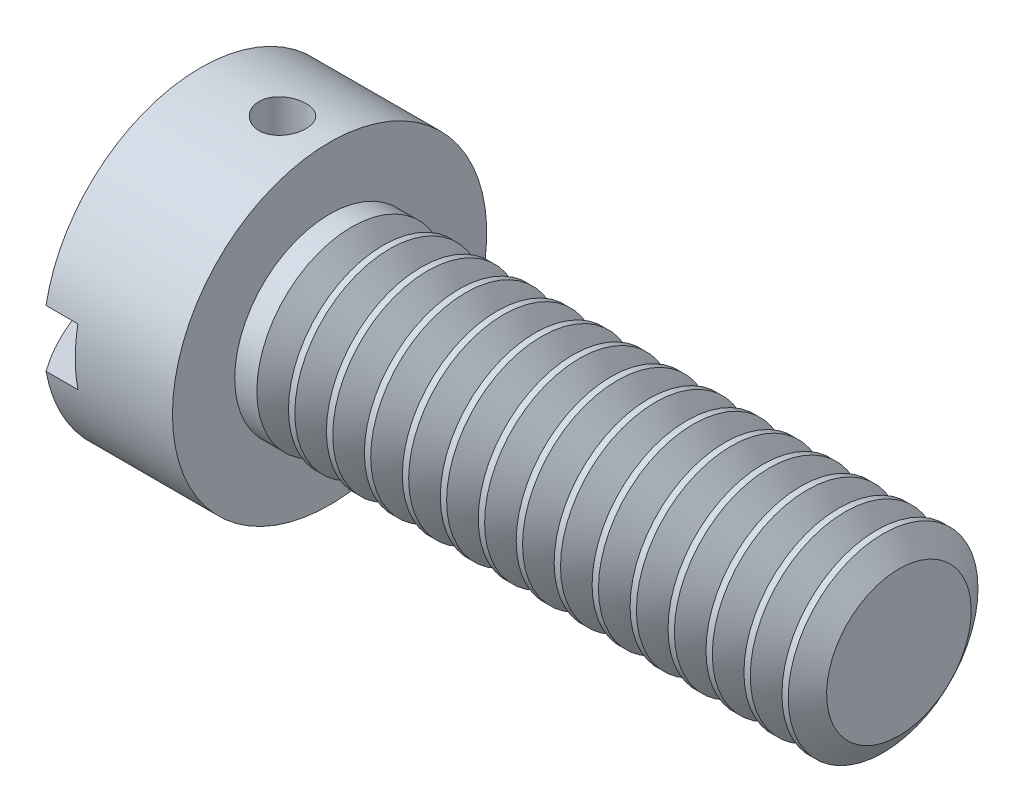
from build123d import *

# Parameters (mm, degrees)
SKETCH2_W       = 10.5156
SKETCH2_H       = 1.905
SLOT_DEPTH      = 2.7686
HOLE_DEPTH      = 27.149259908
HOLE_DEPTH_BACK = 27.149259908
SKETCH5_R       = 0.7874
THDSCHPAT_COUNT = 15
THDSCHPAT_PITCH = 1.27


with BuildPart() as part:
    # BodySke → Base-Revolve (revolve)
    with BuildSketch(Plane.XY, mode=Mode.PRIVATE) as base_revolve_sk:
        with BuildLine():
            Line((6.0198, 3.175), (6.0198, 5.2578))
            Line((6.0198, 5.2578), (1.7018, 5.2578))
            ThreePointArc((1.7018, 5.2578), (0.436044816, 2.763176799), (0, 0))
            Line((0, 0), (25.0698, 0))
            Line((25.0698, 0), (25.0698, 3.175))
            Line((25.0698, 3.175), (6.0198, 3.175))
        make_face()
    revolve(base_revolve_sk.sketch.rotate(Axis((-25.4, 0, 0), (1, 0, 0)), 90), axis=Axis((-25.4, 0, 0), (1, 0, 0)))

    # Sketch2 → Slot (cut)
    with BuildSketch(Plane(origin=(0, 0, 0), x_dir=(0, 0, -1), z_dir=(1, 0, 0))):
        Rectangle(SKETCH2_W, SKETCH2_H)
    extrude(amount=SLOT_DEPTH, mode=Mode.SUBTRACT)

    # Sketch5 → Hole (cut, two sides: drawn at the far end of the back side and taken through both)
    with BuildSketch(Plane(origin=(0, 0, 0), x_dir=(1, 0, 0), z_dir=(0, 1, 0)).offset(-HOLE_DEPTH_BACK)):
        with Locations(Location((4.445, 0, 0), (0, 0, 270))):
            Circle(SKETCH5_R)
    extrude(amount=HOLE_DEPTH + HOLE_DEPTH_BACK, mode=Mode.SUBTRACT)

    # ThdSchSke → ThreadSchematic (revolve, cut)
    with BuildSketch(Plane.XY):
        Polygon((7.2898, -2.41935), (6.760688174, -3.175), (6.760688174, -3.96875), (7.818911826, -3.96875), (7.818911826, -3.175), align=None)
    threadschematic = revolve(axis=Axis((-3.175, 0, 0), (1, 0, 0)), mode=Mode.SUBTRACT)

    # ThdSchPat: ThreadSchematic ×15
    with Locations(*[(i * THDSCHPAT_PITCH, 0, 0) for i in range(1, THDSCHPAT_COUNT)]):
        add(threadschematic, mode=Mode.SUBTRACT)


solid = part.part
